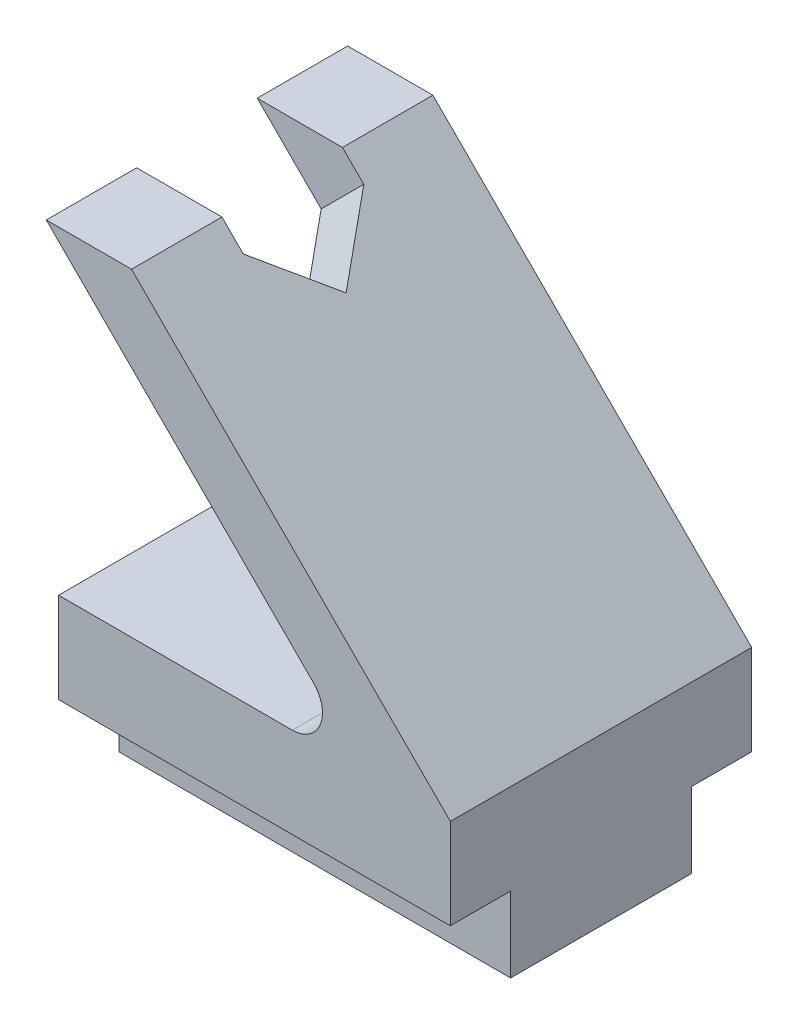
from build123d import *

# Parameters (mm, degrees)
EXTRUDE_1_DEPTH          = 40
SKETCH_4_W               = 52
SKETCH_4_H               = 10
CUT_EXTRUDE_1_DEPTH      = 8
SKETCH_7_W               = 52
SKETCH_7_H               = 10
CUT_EXTRUDE_2_DEPTH      = 8
CUT_EXTRUDE_3_DEPTH      = 67.792933004
CUT_EXTRUDE_3_DEPTH_BACK = 67.792933004


with BuildPart() as part:
    # 草圖2 → 填料-伸長1 (new body)
    with BuildSketch(Plane.XY):
        with BuildLine():
            Line((0, 0), (52, 0))
            Line((52, 0), (52, 22))
            Line((52, 22), (9.683462586, 64.316537414))
            Line((9.683462586, 64.316537414), (-1.630245913, 64.316537414))
            Line((-1.630245913, 64.316537414), (33.857864376, 28.828427125))
            ThreePointArc((33.857864376, 28.828427125), (34.724955382, 24.469266271), (31.029437252, 22))
            Line((31.029437252, 22), (0, 22))
            Line((0, 22), (0, 0))
        make_face()
    extrude(amount=-EXTRUDE_1_DEPTH)

    # 草圖4 → 除料-伸長1 (cut)
    with BuildSketch(Plane.XY):
        with Locations((26, 5)):
            Rectangle(SKETCH_4_W, SKETCH_4_H)
    extrude(amount=-CUT_EXTRUDE_1_DEPTH, mode=Mode.SUBTRACT)

    # 草圖7 → 除料-伸長2 (cut)
    with BuildSketch(Plane(origin=(0, 0, -40), x_dir=(-1, 0, 0), z_dir=(0, 0, -1))):
        with Locations((-26, 5)):
            Rectangle(SKETCH_7_W, SKETCH_7_H)
    extrude(amount=-CUT_EXTRUDE_2_DEPTH, mode=Mode.SUBTRACT)

    # 草圖9 → 除料-伸長3 (cut, two sides: drawn at the far end of the back side and taken through both)
    with BuildSketch(Plane(origin=(37, 37, 0), x_dir=(0, 0, -1), z_dir=(0.7071067811865432, 0.7071067811865519, 0)).offset(-CUT_EXTRUDE_3_DEPTH_BACK)):
        Polygon((12, 232.582795613), (12, 46.631417687), (12, 34.631417687), (20, 26.631417687), (28, 34.631417687), (28, 46.631417687), (28, 232.582795613), (28, 604.485551465), (12, 604.485551465), align=None)
    extrude(amount=CUT_EXTRUDE_3_DEPTH + CUT_EXTRUDE_3_DEPTH_BACK, mode=Mode.SUBTRACT)


solid = part.part
